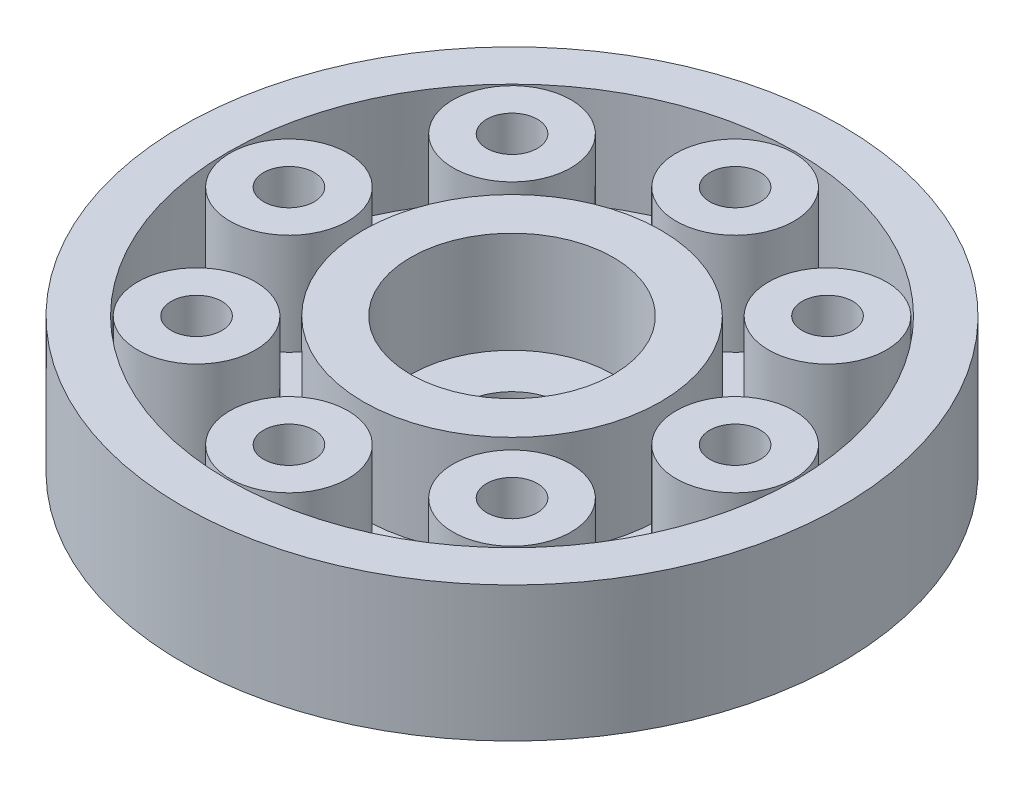
from build123d import *

# Parameters (mm, degrees)
SKETCH_1_R          = 9.75
EXTRUDE_1_DEPTH     = 3
EXTRUDE_START       = 1
SKETCH_2_R          = 9.75
EXTRUDE_2_DEPTH     = 1
SKETCH_4_R          = 1.5
CUT_EXTRUDE_4_DEPTH = 1
SKETCH_5_R          = 8.4
SKETCH_5_R_2        = 4.4
CUT_EXTRUDE_5_DEPTH = 10
SKETCH_6_R          = 1.744482362
SKETCH_6_R_2        = 0.75
EXTRUDE_3_DEPTH     = 3
SKETCH_7_R          = 0.75
SKETCH_7_R_2        = 1.5
CUT_EXTRUDE_6_DEPTH = 3
SKETCH_8_R          = 4
CUT_EXTRUDE_7_DEPTH = 3
EXTRUDE_START_2     = 3
SKETCH_9_R          = 4
SKETCH_9_R_2        = 3
EXTRUDE_4_DEPTH     = 3


with BuildPart() as part:
    # 草图1 → 凸台-拉伸1 (new body)
    with BuildSketch(Plane(origin=(0, 0, 0), x_dir=(1, 0, 0), z_dir=(0, 1, 0))):
        with Locations(Location((0.394660743, -0.591991115, 0), (0, 0, 270))):
            Circle(SKETCH_1_R)
        with BuildLine():
            ThreePointArc((-0.026116093, 2.25205035), (-0.201664975, 2.520045602), (-0.42818362, 2.746602811))
            ThreePointArc((-0.42818362, 2.746602811), (-0.460459434, 2.738482084), (-0.492655135, 2.73004934))
            ThreePointArc((-0.492655135, 2.73004934), (-0.582010169, 2.422389555), (-0.606737129, 2.102972206))
            ThreePointArc((-0.606737129, 2.102972206), (-0.663697346, 2.081116282), (-0.720180966, 2.058056613))
            ThreePointArc((-0.720180966, 2.058056613), (-0.956862366, 2.27397507), (-1.232606998, 2.437081672))
            ThreePointArc((-1.232606998, 2.437081672), (-1.261849265, 2.421189404), (-1.290936341, 2.405014844))
            ThreePointArc((-1.290936341, 2.405014844), (-1.300972245, 2.084799064), (-1.245486498, 1.769267453))
            ThreePointArc((-1.245486498, 1.769267453), (-1.295221857, 1.733932744), (-1.344196234, 1.697550632))
            ThreePointArc((-1.344196234, 1.697550632), (-1.62713859, 1.847825343), (-1.934783159, 1.937232749))
            ThreePointArc((-1.934783159, 1.937232749), (-1.95915448, 1.91456751), (-1.983305283, 1.891667442))
            ThreePointArc((-1.983305283, 1.891667442), (-1.913391464, 1.579016002), (-1.781179383, 1.287196141))
            ThreePointArc((-1.781179383, 1.287196141), (-1.82056483, 1.240602855), (-1.858952723, 1.193184322))
            ThreePointArc((-1.858952723, 1.193184322), (-2.170377725, 1.268372974), (-2.490591793, 1.278463389))
            ThreePointArc((-2.490591793, 1.278463389), (-2.508560828, 1.250449319), (-2.526257873, 1.222262639))
            ThreePointArc((-2.526257873, 1.222262639), (-2.380787274, 0.936820578), (-2.180156231, 0.687048582))
            ThreePointArc((-2.180156231, 0.687048582), (-2.206717032, 0.632124348), (-2.23210639, 0.576648875))
            ThreePointArc((-2.23210639, 0.576648875), (-2.552446061, 0.572027088), (-2.865109398, 0.502166494))
            ThreePointArc((-2.865109398, 0.502166494), (-2.875547088, 0.47056382), (-2.885678405, 0.4388616))
            ThreePointArc((-2.885678405, 0.4388616), (-2.673791479, 0.198564293), (-2.417347859, 0.006534255))
            ThreePointArc((-2.417347859, 0.006534255), (-2.429415102, -0.053269836), (-2.440210618, -0.113316522))
            ThreePointArc((-2.440210618, -0.113316522), (-2.749336837, -0.197458343), (-3.034803657, -0.342880348))
            ThreePointArc((-3.034803657, -0.342880348), (-3.037054162, -0.376085914), (-3.038983164, -0.409311707))
            ThreePointArc((-3.038983164, -0.409311707), (-2.773993545, -0.589365496), (-2.477850645, -0.711587622))
            ThreePointArc((-2.477850645, -0.711587622), (-2.474666101, -0.772513859), (-2.470189451, -0.833358803))
            ThreePointArc((-2.470189451, -0.833358803), (-2.748678682, -0.991733719), (-2.989012055, -1.203579736))
            ThreePointArc((-2.989012055, -1.203579736), (-2.982933968, -1.236301765), (-2.976539448, -1.268963432))
            ThreePointArc((-2.976539448, -1.268963432), (-2.675097409, -1.377460262), (-2.357862976, -1.422194811))
            ThreePointArc((-2.357862976, -1.422194811), (-2.339626741, -1.480414974), (-2.320159211, -1.538235065))
            ThreePointArc((-2.320159211, -1.538235065), (-2.550512951, -1.760891797), (-2.730611847, -2.025850761))
            ThreePointArc((-2.730611847, -2.025850761), (-2.716587076, -2.056033209), (-2.702270826, -2.086078497))
            ThreePointArc((-2.702270826, -2.086078497), (-2.383317078, -2.116201113), (-2.064924118, -2.080637248))
            ThreePointArc((-2.064924118, -2.080637248), (-2.032782042, -2.132493151), (-1.999546849, -2.18365534))
            ThreePointArc((-1.999546849, -2.18365534), (-2.167291125, -2.456603546), (-2.275839268, -2.758027112))
            ThreePointArc((-2.275839268, -2.758027112), (-2.254749042, -2.783773504), (-2.233410603, -2.809314557))
            ThreePointArc((-2.233410603, -2.809314557), (-1.916986184, -2.759170244), (-1.617440498, -2.645542574))
            ThreePointArc((-1.617440498, -2.645542574), (-1.573412186, -2.687775919), (-1.528497619, -2.729065497))
            ThreePointArc((-1.528497619, -2.729065497), (-1.623092441, -3.035154839), (-1.653269352, -3.354103454))
            ThreePointArc((-1.653269352, -3.354103454), (-1.626438847, -3.37379605), (-1.599418993, -3.393228031))
            ThreePointArc((-1.599418993, -3.393228031), (-1.305406012, -3.26596754), (-1.043529157, -3.081415709))
            ThreePointArc((-1.043529157, -3.081415709), (-0.99038107, -3.11137282), (-0.936609275, -3.140195412))
            ThreePointArc((-0.936609275, -3.140195412), (-0.952110903, -3.460193169), (-0.902020456, -3.77662612))
            ThreePointArc((-0.902020456, -3.77662612), (-0.871135531, -3.789027562), (-0.840132018, -3.801129486))
            ThreePointArc((-0.840132018, -3.801129486), (-0.587004393, -3.604749063), (-0.379251055, -3.360869142))
            ThreePointArc((-0.379251055, -3.360869142), (-0.320322682, -3.376667703), (-0.261072341, -3.391212279))
            ThreePointArc((-0.261072341, -3.391212279), (-0.19650675, -3.705011816), (-0.069296312, -3.999046457))
            ThreePointArc((-0.069296312, -3.999046457), (-0.03629758, -4.003377516), (-0.003258474, -4.007388976))
            ThreePointArc((-0.003258474, -4.007388976), (0.193078856, -3.754227924), (0.333654771, -3.466343785))
            ThreePointArc((0.333654771, -3.466343785), (0.394660743, -3.466991115), (0.455666715, -3.466343785))
            ThreePointArc((0.455666715, -3.466343785), (0.596242631, -3.754227924), (0.792579961, -4.007388976))
            ThreePointArc((0.792579961, -4.007388976), (0.825619067, -4.003377516), (0.858617799, -3.999046457))
            ThreePointArc((0.858617799, -3.999046457), (0.985828237, -3.705011816), (1.050393827, -3.391212279))
            ThreePointArc((1.050393827, -3.391212279), (1.109644169, -3.376667703), (1.168572542, -3.360869142))
            ThreePointArc((1.168572542, -3.360869142), (1.37632588, -3.604749063), (1.629453505, -3.801129486))
            ThreePointArc((1.629453505, -3.801129486), (1.660457018, -3.789027562), (1.691341943, -3.77662612))
            ThreePointArc((1.691341943, -3.77662612), (1.74143239, -3.460193169), (1.725930762, -3.140195412))
            ThreePointArc((1.725930762, -3.140195412), (1.779702556, -3.11137282), (1.832850644, -3.081415709))
            ThreePointArc((1.832850644, -3.081415709), (2.094727499, -3.26596754), (2.388740479, -3.393228031))
            ThreePointArc((2.388740479, -3.393228031), (2.415760333, -3.37379605), (2.442590839, -3.354103454))
            ThreePointArc((2.442590839, -3.354103454), (2.412413927, -3.035154839), (2.317819105, -2.729065497))
            ThreePointArc((2.317819105, -2.729065497), (2.362733673, -2.687775919), (2.406761985, -2.645542574))
            ThreePointArc((2.406761985, -2.645542574), (2.706307671, -2.759170244), (3.02273209, -2.809314557))
            ThreePointArc((3.02273209, -2.809314557), (3.044070529, -2.783773504), (3.065160755, -2.758027112))
            ThreePointArc((3.065160755, -2.758027112), (2.956612612, -2.456603546), (2.788868336, -2.18365534))
            ThreePointArc((2.788868336, -2.18365534), (2.822103529, -2.132493151), (2.854245605, -2.080637248))
            ThreePointArc((2.854245605, -2.080637248), (3.172638565, -2.116201113), (3.491592313, -2.086078497))
            ThreePointArc((3.491592313, -2.086078497), (3.505908563, -2.056033209), (3.519933334, -2.025850761))
            ThreePointArc((3.519933334, -2.025850761), (3.339834438, -1.760891797), (3.109480698, -1.538235065))
            ThreePointArc((3.109480698, -1.538235065), (3.128948228, -1.480414974), (3.147184462, -1.422194811))
            ThreePointArc((3.147184462, -1.422194811), (3.464418895, -1.377460262), (3.765860935, -1.268963432))
            ThreePointArc((3.765860935, -1.268963432), (3.772255455, -1.236301765), (3.778333542, -1.203579736))
            ThreePointArc((3.778333542, -1.203579736), (3.538000169, -0.991733719), (3.259510938, -0.833358803))
            ThreePointArc((3.259510938, -0.833358803), (3.263987588, -0.772513859), (3.267172132, -0.711587622))
            ThreePointArc((3.267172132, -0.711587622), (3.563315032, -0.589365496), (3.828304651, -0.409311707))
            ThreePointArc((3.828304651, -0.409311707), (3.826375649, -0.376085914), (3.824125144, -0.342880348))
            ThreePointArc((3.824125144, -0.342880348), (3.538658323, -0.197458343), (3.229532104, -0.113316522))
            ThreePointArc((3.229532104, -0.113316522), (3.218736589, -0.053269836), (3.206669346, 0.006534255))
            ThreePointArc((3.206669346, 0.006534255), (3.463112965, 0.198564293), (3.674999892, 0.4388616))
            ThreePointArc((3.674999892, 0.4388616), (3.664868575, 0.47056382), (3.654430885, 0.502166494))
            ThreePointArc((3.654430885, 0.502166494), (3.341767547, 0.572027088), (3.021427877, 0.576648875))
            ThreePointArc((3.021427877, 0.576648875), (2.996038519, 0.632124348), (2.969477718, 0.687048582))
            ThreePointArc((2.969477718, 0.687048582), (3.170108761, 0.936820578), (3.31557936, 1.222262639))
            ThreePointArc((3.31557936, 1.222262639), (3.297882315, 1.250449319), (3.279913279, 1.278463389))
            ThreePointArc((3.279913279, 1.278463389), (2.959699212, 1.268372974), (2.64827421, 1.193184322))
            ThreePointArc((2.64827421, 1.193184322), (2.609886316, 1.240602855), (2.57050087, 1.287196141))
            ThreePointArc((2.57050087, 1.287196141), (2.702712951, 1.579016002), (2.772626769, 1.891667442))
            ThreePointArc((2.772626769, 1.891667442), (2.748475967, 1.91456751), (2.724104646, 1.937232749))
            ThreePointArc((2.724104646, 1.937232749), (2.416460076, 1.847825343), (2.133517721, 1.697550632))
            ThreePointArc((2.133517721, 1.697550632), (2.084543344, 1.733932744), (2.034807985, 1.769267453))
            ThreePointArc((2.034807985, 1.769267453), (2.090293731, 2.084799064), (2.080257828, 2.405014844))
            ThreePointArc((2.080257828, 2.405014844), (2.051170752, 2.421189404), (2.021928485, 2.437081672))
            ThreePointArc((2.021928485, 2.437081672), (1.746183853, 2.27397507), (1.509502453, 2.058056613))
            ThreePointArc((1.509502453, 2.058056613), (1.453018832, 2.081116282), (1.396058616, 2.102972206))
            ThreePointArc((1.396058616, 2.102972206), (1.371331655, 2.422389555), (1.281976622, 2.73004934))
            ThreePointArc((1.281976622, 2.73004934), (1.24978092, 2.738482084), (1.217505107, 2.746602811))
            ThreePointArc((1.217505107, 2.746602811), (0.990986462, 2.520045602), (0.81543758, 2.25205035))
            ThreePointArc((0.81543758, 2.25205035), (0.75499379, 2.260338651), (0.694387736, 2.267342501))
            ThreePointArc((0.694387736, 2.267342501), (0.591001754, 2.570575422), (0.427942096, 2.846347815))
            ThreePointArc((0.427942096, 2.846347815), (0.394660743, 2.846508885), (0.361379391, 2.846347815))
            ThreePointArc((0.361379391, 2.846347815), (0.198319733, 2.570575422), (0.094933751, 2.267342501))
            ThreePointArc((0.094933751, 2.267342501), (0.034327697, 2.260338651), (-0.026116093, 2.25205035))
        make_face(mode=Mode.SUBTRACT)
    extrude(amount=EXTRUDE_1_DEPTH)

    # 草图2 → 凸台-拉伸2 (add)
    with BuildSketch(Plane(origin=(0, 0, 0), x_dir=(-1, 0, 0), z_dir=(0, -1, 0)).offset(EXTRUDE_START)):
        with Locations(Location((-0.394660743, -0.591991115, 0), (0, 0, 90))):
            Circle(SKETCH_2_R)
    extrude(amount=-EXTRUDE_2_DEPTH)

    # 草图4 → 切除-拉伸4 (cut)
    with BuildSketch(Plane(origin=(0, 0, 0), x_dir=(1, 0, 0), z_dir=(0, 1, 0))):
        with Locations(Location((0.394660743, -0.591991115, 0), (0, 0, 270))):
            Circle(SKETCH_4_R)
    extrude(amount=-CUT_EXTRUDE_4_DEPTH, mode=Mode.SUBTRACT)

    # 草图5 → 切除-拉伸5 (cut)
    with BuildSketch(Plane(origin=(0, 0, 0), x_dir=(-1, 0, 0), z_dir=(0, -1, 0))):
        with Locations(Location((-0.394660743, -0.591991115, 0), (0, 0, 90))):
            Circle(SKETCH_5_R)
        with Locations(Location((-0.394660743, -0.591991115, 0), (0, 0, 90))):
            Circle(SKETCH_5_R_2, mode=Mode.SUBTRACT)
    extrude(amount=-CUT_EXTRUDE_5_DEPTH, mode=Mode.SUBTRACT)

    # 草图6 → 凸台-拉伸3 (add)
    # profile 1 of 8: a face of its own
    with BuildSketch(Plane(origin=(0, 0, 0), x_dir=(-1, 0, 0), z_dir=(0, -1, 0))):
        with Locations(Location((-0.394660743, 6.008008885, 0), (0, 0, 90))):
            Circle(SKETCH_6_R)
        with Locations(Location((-0.394660743, 6.008008885, 0), (0, 0, 90))):
            Circle(SKETCH_6_R_2, mode=Mode.SUBTRACT)
    # profile 2 of 8: a face of its own
    with BuildSketch(Plane(origin=(0, 0, 0), x_dir=(-1, 0, 0), z_dir=(0, -1, 0))):
        with Locations(Location((4.272244012, 4.074913641, 0), (0, 0, 90))):
            Circle(SKETCH_6_R)
        with Locations(Location((4.272244012, 4.074913641, 0), (0, 0, 90))):
            Circle(SKETCH_6_R_2, mode=Mode.SUBTRACT)
    # profile 3 of 8: a face of its own
    with BuildSketch(Plane(origin=(0, 0, 0), x_dir=(-1, 0, 0), z_dir=(0, -1, 0))):
        with Locations(Location((6.205339257, -0.591991115, 0), (0, 0, 90))):
            Circle(SKETCH_6_R)
        with Locations(Location((6.205339257, -0.591991115, 0), (0, 0, 90))):
            Circle(SKETCH_6_R_2, mode=Mode.SUBTRACT)
    # profile 4 of 8: a face of its own
    with BuildSketch(Plane(origin=(0, 0, 0), x_dir=(-1, 0, 0), z_dir=(0, -1, 0))):
        with Locations(Location((4.272244012, -5.258895871, 0), (0, 0, 90))):
            Circle(SKETCH_6_R)
        with Locations(Location((4.272244012, -5.258895871, 0), (0, 0, 90))):
            Circle(SKETCH_6_R_2, mode=Mode.SUBTRACT)
    # profile 5 of 8: a face of its own
    with BuildSketch(Plane(origin=(0, 0, 0), x_dir=(-1, 0, 0), z_dir=(0, -1, 0))):
        with Locations(Location((-0.394660743, -7.191991115, 0), (0, 0, 90))):
            Circle(SKETCH_6_R)
        with Locations(Location((-0.394660743, -7.191991115, 0), (0, 0, 90))):
            Circle(SKETCH_6_R_2, mode=Mode.SUBTRACT)
    # profile 6 of 8: a face of its own
    with BuildSketch(Plane(origin=(0, 0, 0), x_dir=(-1, 0, 0), z_dir=(0, -1, 0))):
        with Locations(Location((-5.061565499, -5.258895871, 0), (0, 0, 90))):
            Circle(SKETCH_6_R)
        with Locations(Location((-5.061565499, -5.258895871, 0), (0, 0, 90))):
            Circle(SKETCH_6_R_2, mode=Mode.SUBTRACT)
    # profile 7 of 8: a face of its own
    with BuildSketch(Plane(origin=(0, 0, 0), x_dir=(-1, 0, 0), z_dir=(0, -1, 0))):
        with Locations(Location((-6.994660743, -0.591991115, 0), (0, 0, 90))):
            Circle(SKETCH_6_R)
        with Locations(Location((-6.994660743, -0.591991115, 0), (0, 0, 90))):
            Circle(SKETCH_6_R_2, mode=Mode.SUBTRACT)
    # profile 8 of 8: a face of its own
    with BuildSketch(Plane(origin=(0, 0, 0), x_dir=(-1, 0, 0), z_dir=(0, -1, 0))):
        with Locations(Location((-5.061565499, 4.074913641, 0), (0, 0, 90))):
            Circle(SKETCH_6_R)
        with Locations(Location((-5.061565499, 4.074913641, 0), (0, 0, 90))):
            Circle(SKETCH_6_R_2, mode=Mode.SUBTRACT)
    extrude(amount=-EXTRUDE_3_DEPTH)

    # 草图7 → 切除-拉伸6 (cut)
    with BuildSketch(Plane(origin=(0, -1, 0), x_dir=(-1, 0, 0), z_dir=(0, -1, 0))):
        with Locations(Location((-0.394660743, 6.008008885, 0), (0, 0, 90))):
            Circle(SKETCH_7_R)
        with Locations(Location((-0.394660743, -0.591991115, 0), (0, 0, 270))):
            Circle(SKETCH_7_R_2)
        with Locations(Location((4.272244012, 4.074913641, 0), (0, 0, 90))):
            Circle(SKETCH_7_R)
        with Locations(Location((6.205339257, -0.591991115, 0), (0, 0, 90))):
            Circle(SKETCH_7_R)
        with Locations(Location((4.272244012, -5.258895871, 0), (0, 0, 90))):
            Circle(SKETCH_7_R)
        with Locations(Location((-0.394660743, -7.191991115, 0), (0, 0, 90))):
            Circle(SKETCH_7_R)
        with Locations(Location((-5.061565499, -5.258895871, 0), (0, 0, 90))):
            Circle(SKETCH_7_R)
        with Locations(Location((-6.994660743, -0.591991115, 0), (0, 0, 90))):
            Circle(SKETCH_7_R)
        with Locations(Location((-5.061565499, 4.074913641, 0), (0, 0, 90))):
            Circle(SKETCH_7_R)
    extrude(amount=-CUT_EXTRUDE_6_DEPTH, mode=Mode.SUBTRACT)

    # 草图8 → 切除-拉伸7 (cut)
    with BuildSketch(Plane(origin=(0, 3, 0), x_dir=(1, 0, 0), z_dir=(0, 1, 0))):
        with Locations(Location((0.394660743, -0.591991115, 0), (0, 0, 270))):
            Circle(SKETCH_8_R)
    extrude(amount=-CUT_EXTRUDE_7_DEPTH, mode=Mode.SUBTRACT)

    # 草图9 → 凸台-拉伸4 (add)
    with BuildSketch(Plane(origin=(0, 0, 0), x_dir=(1, 0, 0), z_dir=(0, 1, 0)).offset(EXTRUDE_START_2)):
        with Locations((0.394660743, -0.591991115)):
            Circle(SKETCH_9_R)
        with Locations(Location((0.394660743, -0.591991115, 0), (0, 0, 270))):
            Circle(SKETCH_9_R_2, mode=Mode.SUBTRACT)
    extrude(amount=-EXTRUDE_4_DEPTH)


solid = part.part
